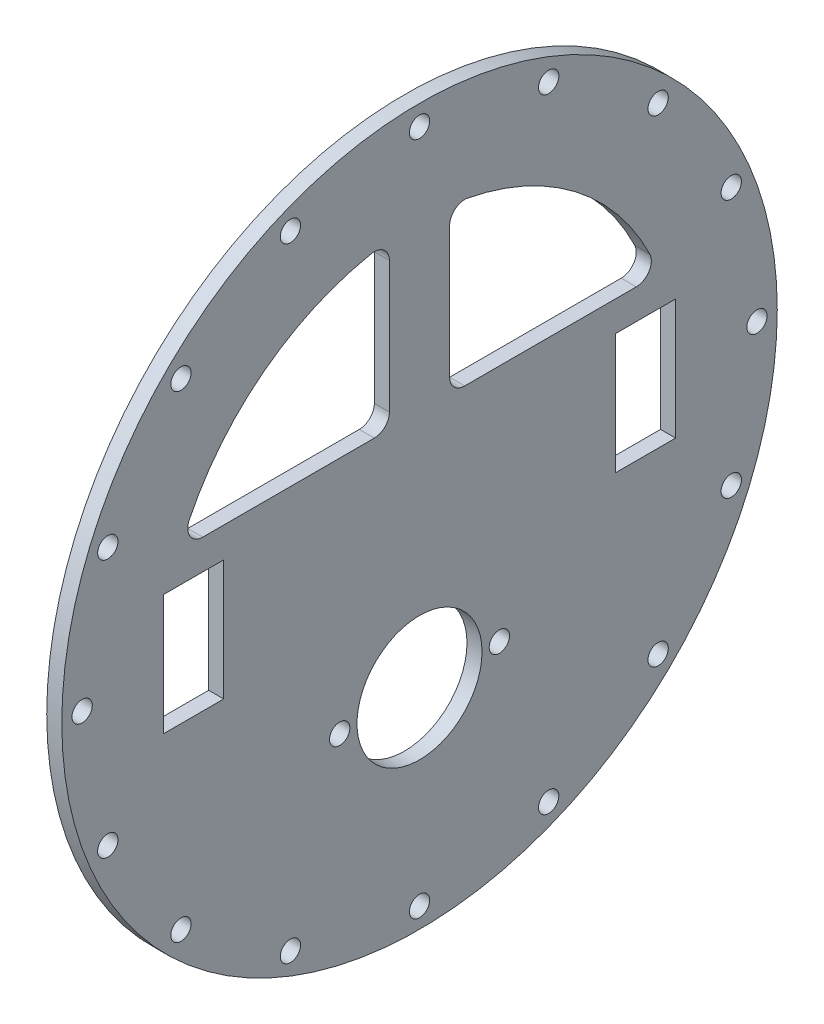
from build123d import *

# Parameters (mm, degrees)
ESQUISSE1_R        = 6.75
ESQUISSE1_R_2      = 41.5
ESQUISSE1_W        = 40
ESQUISSE1_H        = 80
BOSS_EXTRU_1_DEPTH = 10
CONG_1_R           = 10


with BuildPart() as part:
    # Esquisse1 → Boss.-Extru.1 (new body)
    with BuildSketch(Plane(origin=(0, 0, 0), x_dir=(0, 0, -1), z_dir=(1, 0, 0))):
        with BuildLine():
            ThreePointArc((233.197877349, -45), (236.422022949, -22.602589781), (237.5, 0))
            ThreePointArc((237.5, 0), (236.422022949, 22.602589781), (233.197877349, 45))
            ThreePointArc((233.197877349, 45), (231.618451309, 52.527545282), (229.796105276, 60))
            ThreePointArc((229.796105276, 60), (0, 237.5), (-229.796105276, 60))
            ThreePointArc((-229.796105276, 60), (-231.618451309, 52.527545282), (-233.197877349, 45))
            ThreePointArc((-233.197877349, 45), (-237.5, 0), (-233.197877349, -45))
            ThreePointArc((-233.197877349, -45), (-231.618451309, -52.527545282), (-229.796105276, -60))
            ThreePointArc((-229.796105276, -60), (0, -237.5), (229.796105276, -60))
            ThreePointArc((229.796105276, -60), (231.618451309, -52.527545282), (233.197877349, -45))
        make_face()
        with Locations((-158.391918986, -158.391918986)):
            Circle(ESQUISSE1_R, mode=Mode.SUBTRACT)
        with Locations((-85.72108885, -206.949015283)):
            Circle(ESQUISSE1_R, mode=Mode.SUBTRACT)
        with Locations((0, -224)):
            Circle(ESQUISSE1_R, mode=Mode.SUBTRACT)
        with Locations((-206.949015283, -85.72108885)):
            Circle(ESQUISSE1_R, mode=Mode.SUBTRACT)
        with Locations((-224, 0)):
            Circle(ESQUISSE1_R, mode=Mode.SUBTRACT)
        with Locations((-53, -98.5)):
            Circle(ESQUISSE1_R, mode=Mode.SUBTRACT)
        with Locations((85.72108885, -206.949015283)):
            Circle(ESQUISSE1_R, mode=Mode.SUBTRACT)
        with Locations((158.391918986, -158.391918986)):
            Circle(ESQUISSE1_R, mode=Mode.SUBTRACT)
        with Locations((0, -98.5)):
            Circle(ESQUISSE1_R_2, mode=Mode.SUBTRACT)
        with Locations((53, -98.5)):
            Circle(ESQUISSE1_R, mode=Mode.SUBTRACT)
        with Locations((206.949015283, -85.72108885)):
            Circle(ESQUISSE1_R, mode=Mode.SUBTRACT)
        with Locations((150, 0)):
            Rectangle(ESQUISSE1_W, ESQUISSE1_H, mode=Mode.SUBTRACT)
        with Locations((224, 0)):
            Circle(ESQUISSE1_R, mode=Mode.SUBTRACT)
        with Locations((-150, 0)):
            Rectangle(ESQUISSE1_W, ESQUISSE1_H, mode=Mode.SUBTRACT)
        with Locations((-206.949015283, 85.72108885)):
            Circle(ESQUISSE1_R, mode=Mode.SUBTRACT)
        with BuildLine():
            Line((-20, 60), (-159.059737206, 60))
            ThreePointArc((-159.059737206, 60), (-104.766475875, 133.880489739), (-20, 168.819430161))
            Line((-20, 168.819430161), (-20, 60))
        make_face(mode=Mode.SUBTRACT)
        with Locations((-158.391918986, 158.391918986)):
            Circle(ESQUISSE1_R, mode=Mode.SUBTRACT)
        with Locations((-85.72108885, 206.949015283)):
            Circle(ESQUISSE1_R, mode=Mode.SUBTRACT)
        with BuildLine():
            Line((159.059737206, 60), (20, 60))
            Line((20, 60), (20, 168.819430161))
            ThreePointArc((20, 168.819430161), (104.766475875, 133.880489739), (159.059737206, 60))
        make_face(mode=Mode.SUBTRACT)
        with Locations((206.949015283, 85.72108885)):
            Circle(ESQUISSE1_R, mode=Mode.SUBTRACT)
        with Locations((0, 224)):
            Circle(ESQUISSE1_R, mode=Mode.SUBTRACT)
        with Locations((85.72108885, 206.949015283)):
            Circle(ESQUISSE1_R, mode=Mode.SUBTRACT)
        with Locations((158.391918986, 158.391918986)):
            Circle(ESQUISSE1_R, mode=Mode.SUBTRACT)
    extrude(amount=BOSS_EXTRU_1_DEPTH)

    # Congé1
    cong_1_edges = [part.edges().sort_by_distance(p)[0] for p in [
        (5, 60, -159.059737206),
        (5, 168.819430161, -20),
        (5, 60, -20),
        (5, 60, 20),
        (5, 168.819430161, 20),
        (5, 60, 159.059737206),
    ]]
    fillet(cong_1_edges, radius=CONG_1_R)


solid = part.part
